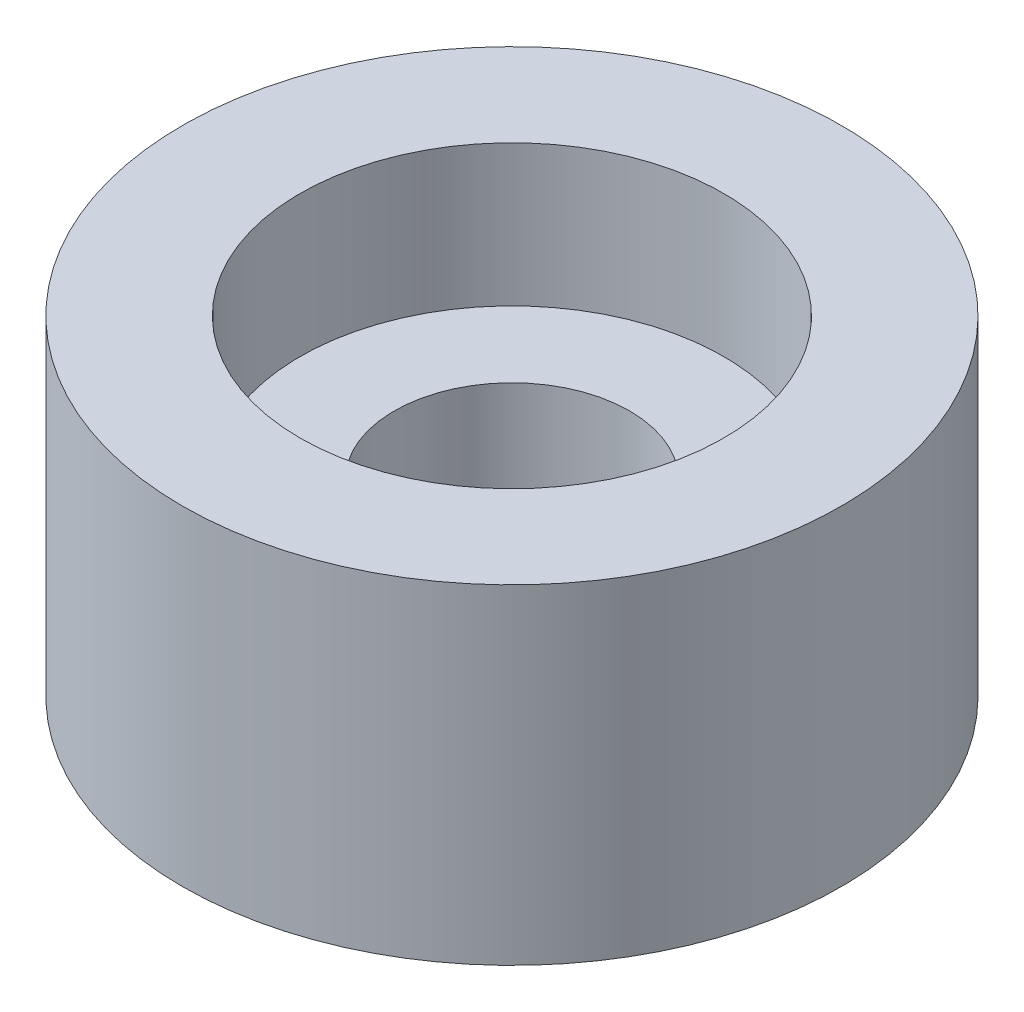
from build123d import *

# Parameters (mm, degrees)
SKETCH1_R           = 3.5
BOSS_EXTRUDE1_DEPTH = 2
SKETCH2_R           = 3.5
SKETCH2_R_2         = 2.25
BOSS_EXTRUDE2_DEPTH = 1.5
SKETCH3_R           = 2
CUT_EXTRUDE1_DEPTH  = 1
SKETCH4_R           = 1.25
CUT_EXTRUDE2_DEPTH  = 1


with BuildPart() as part:
    # Sketch1 → Boss-Extrude1 (new body)
    with BuildSketch(Plane(origin=(0, 0, 0), x_dir=(1, 0, 0), z_dir=(0, 1, 0))):
        with Locations(Location((0, 0, 0), (0, 0, 270))):
            Circle(SKETCH1_R)
    extrude(amount=BOSS_EXTRUDE1_DEPTH)

    # Sketch2 → Boss-Extrude2 (add)
    with BuildSketch(Plane(origin=(0, 2, 0), x_dir=(1, 0, 0), z_dir=(0, 1, 0))):
        with Locations(Location((0, 0, 0), (0, 0, 270))):
            Circle(SKETCH2_R)
        with Locations(Location((0, 0, 0), (0, 0, 270))):
            Circle(SKETCH2_R_2, mode=Mode.SUBTRACT)
    extrude(amount=BOSS_EXTRUDE2_DEPTH)

    # Sketch3 → Cut-Extrude1 (cut)
    with BuildSketch(Plane.XZ):
        with Locations(Location((0, 0, 0), (0, 0, 270))):
            Circle(SKETCH3_R)
    extrude(amount=-CUT_EXTRUDE1_DEPTH, mode=Mode.SUBTRACT)

    # Sketch4 → Cut-Extrude2 (cut)
    with BuildSketch(Plane.XZ.offset(-1)):
        with Locations(Location((0, 0, 0), (0, 0, 270))):
            Circle(SKETCH4_R)
    extrude(amount=-CUT_EXTRUDE2_DEPTH, mode=Mode.SUBTRACT)


solid = part.part
